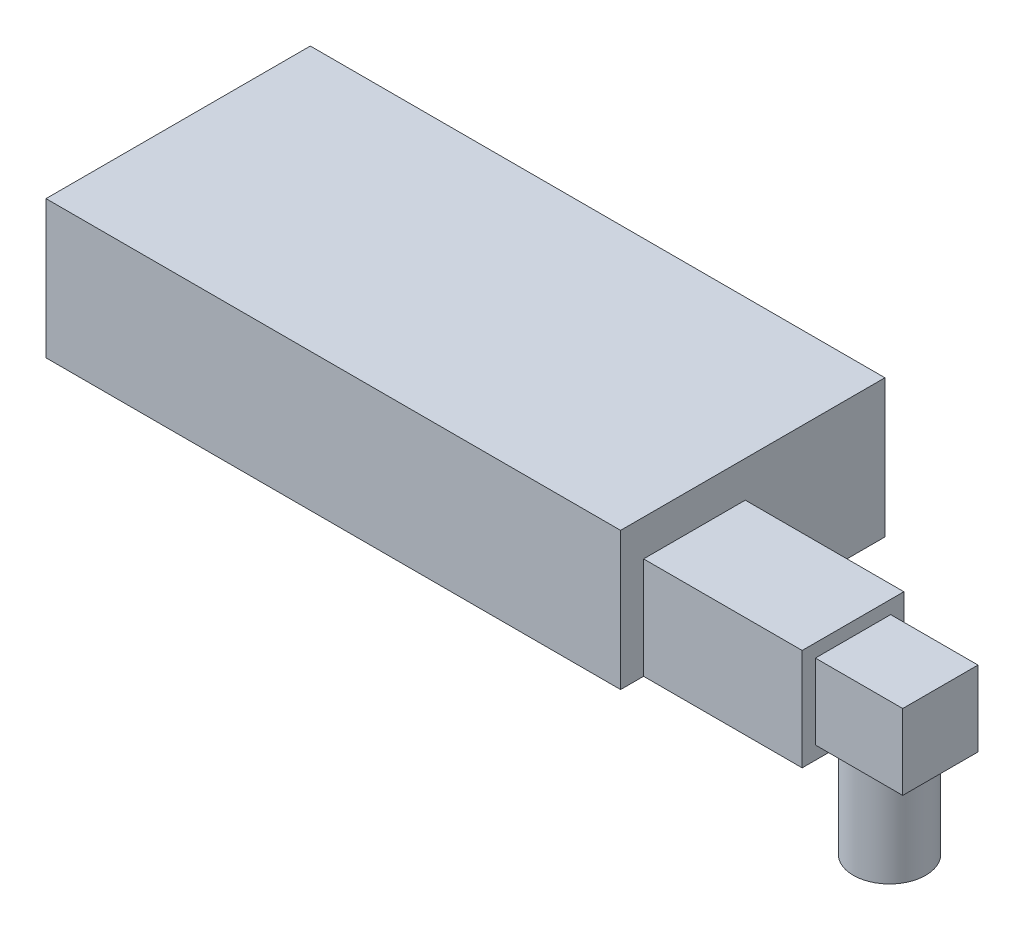
from build123d import *

# Parameters (mm, degrees)
SKETCH1_W           = 50
SKETCH1_H           = 23
BOSS_EXTRUDE2_DEPTH = 12
SKETCH2_W           = 8.85
SKETCH2_H           = 8.85
BOSS_EXTRUDE3_DEPTH = 21.4
SKETCH4_W           = 8.85
SKETCH4_H           = 8.85
SKETCH4_W_2         = 6.55
SKETCH4_H_2         = 6.55
CUT_EXTRUDE1_DEPTH  = 7.6
SKETCH3_R           = 3.15
BOSS_EXTRUDE4_DEPTH = 8.3


with BuildPart() as part:
    # Sketch1 → Boss-Extrude2 (new body)
    with BuildSketch(Plane(origin=(0, 0, 0), x_dir=(1, 0, 0), z_dir=(0, 1, 0))):
        Rectangle(SKETCH1_W, SKETCH1_H)
    extrude(amount=BOSS_EXTRUDE2_DEPTH)


with BuildPart() as body_2:
    # Sketch2 → Boss-Extrude3 (new body)
    with BuildSketch(Plane(origin=(25, 0, 0), x_dir=(0, 0, -1), z_dir=(1, 0, 0))):
        with Locations((-5.075, 4.425)):
            Rectangle(SKETCH2_W, SKETCH2_H)
    extrude(amount=BOSS_EXTRUDE3_DEPTH)

    # Sketch4 → Cut-Extrude1 (cut)
    with BuildSketch(Plane(origin=(46.4, 0, 0), x_dir=(0, 0, -1), z_dir=(1, 0, 0))):
        with Locations((-5.075, 4.425)):
            Rectangle(SKETCH4_W, SKETCH4_H)
        with Locations((-5.075, 4.425)):
            Rectangle(SKETCH4_W_2, SKETCH4_H_2, mode=Mode.SUBTRACT)
    extrude(amount=-CUT_EXTRUDE1_DEPTH, mode=Mode.SUBTRACT)


with BuildPart() as body_3:
    # Sketch3 → Boss-Extrude4 (new body)
    with BuildSketch(Plane(origin=(0, 1.15, 0), x_dir=(1, 0, 0), z_dir=(0, 1, 0))):
        with Locations(Location((41.975, -5.075, 0), (0, 0, 270))):
            Circle(SKETCH3_R)
    extrude(amount=-BOSS_EXTRUDE4_DEPTH)


solid = Compound([part.part, body_2.part, body_3.part])
